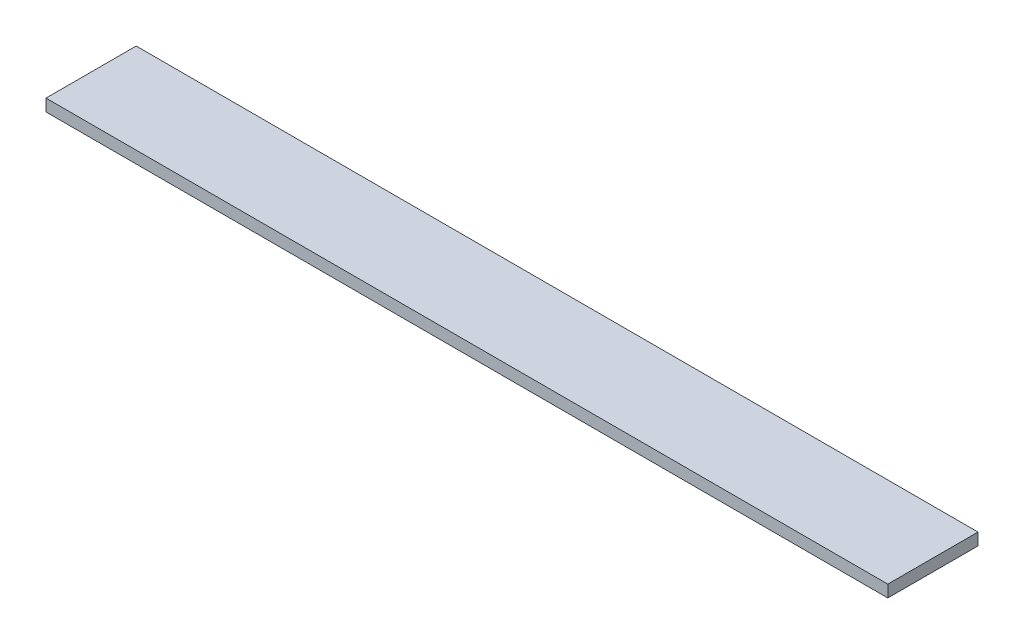
from build123d import *

# Parameters (mm, degrees)
SKETCH1_W           = 140
SKETCH1_H           = 15
BOSS_EXTRUDE1_DEPTH = 2


with BuildPart() as part:
    # Sketch1 → Boss-Extrude1 (new body)
    with BuildSketch(Plane(origin=(0, 0, 0), x_dir=(1, 0, 0), z_dir=(0, 1, 0))):
        Rectangle(SKETCH1_W, SKETCH1_H)
    extrude(amount=BOSS_EXTRUDE1_DEPTH)


solid = part.part
